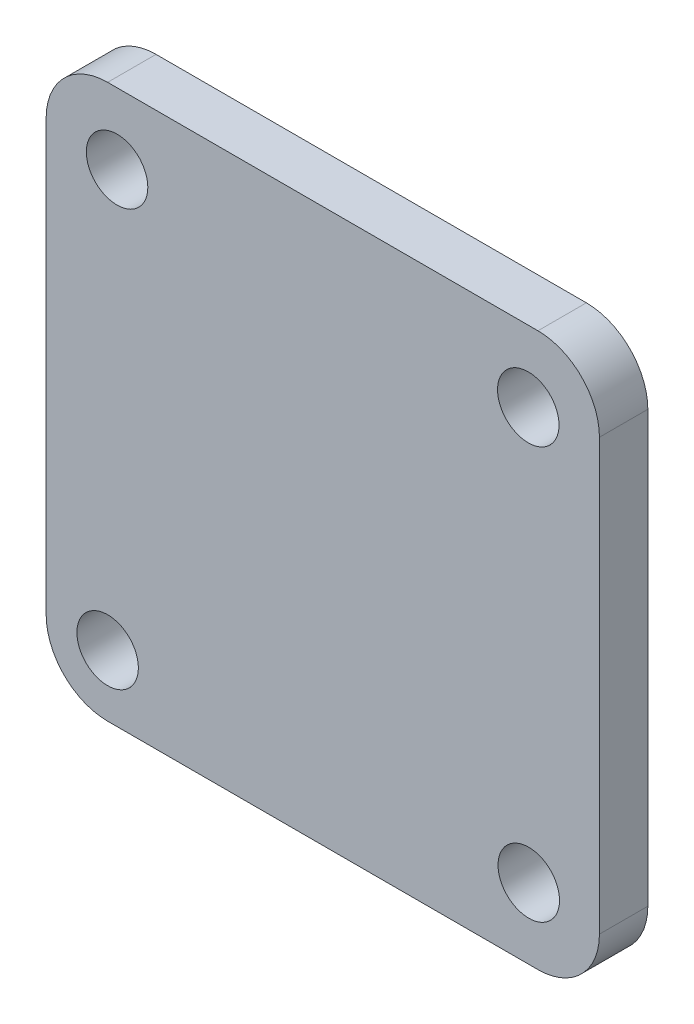
from build123d import *

# Parameters (mm, degrees)
SKETCH1_R           = 1.27
BOSS_EXTRUDE1_DEPTH = 2


with BuildPart() as part:
    # Sketch1 → Boss-Extrude1 (new body)
    with BuildSketch(Plane.XY):
        with BuildLine():
            Line((1695.263396046, -377.107950289), (1713.043396046, -377.107950289))
            ThreePointArc((1713.043396046, -377.107950289), (1714.839447271, -376.364001513), (1715.583396046, -374.567950289))
            Line((1715.583396046, -374.567950289), (1715.583396046, -356.787950289))
            ThreePointArc((1715.583396046, -356.787950289), (1714.839447271, -354.991899064), (1713.043396046, -354.247950289))
            Line((1713.043396046, -354.247950289), (1695.263396046, -354.247950289))
            ThreePointArc((1695.263396046, -354.247950289), (1693.467344822, -354.991899064), (1692.723396046, -356.787950289))
            Line((1692.723396046, -356.787950289), (1692.723396046, -374.567950289))
            ThreePointArc((1692.723396046, -374.567950289), (1693.467344822, -376.364001513), (1695.263396046, -377.107950289))
        make_face()
        with Locations((1695.653396046, -357.176396132)):
            Circle(SKETCH1_R, mode=Mode.SUBTRACT)
        with Locations((1712.643314485, -357.188031851)):
            Circle(SKETCH1_R, mode=Mode.SUBTRACT)
        with Locations((1712.663477608, -374.188031851)):
            Circle(SKETCH1_R, mode=Mode.SUBTRACT)
        with Locations((1695.263396046, -374.567950289)):
            Circle(SKETCH1_R, mode=Mode.SUBTRACT)
    extrude(amount=BOSS_EXTRUDE1_DEPTH)


solid = part.part
